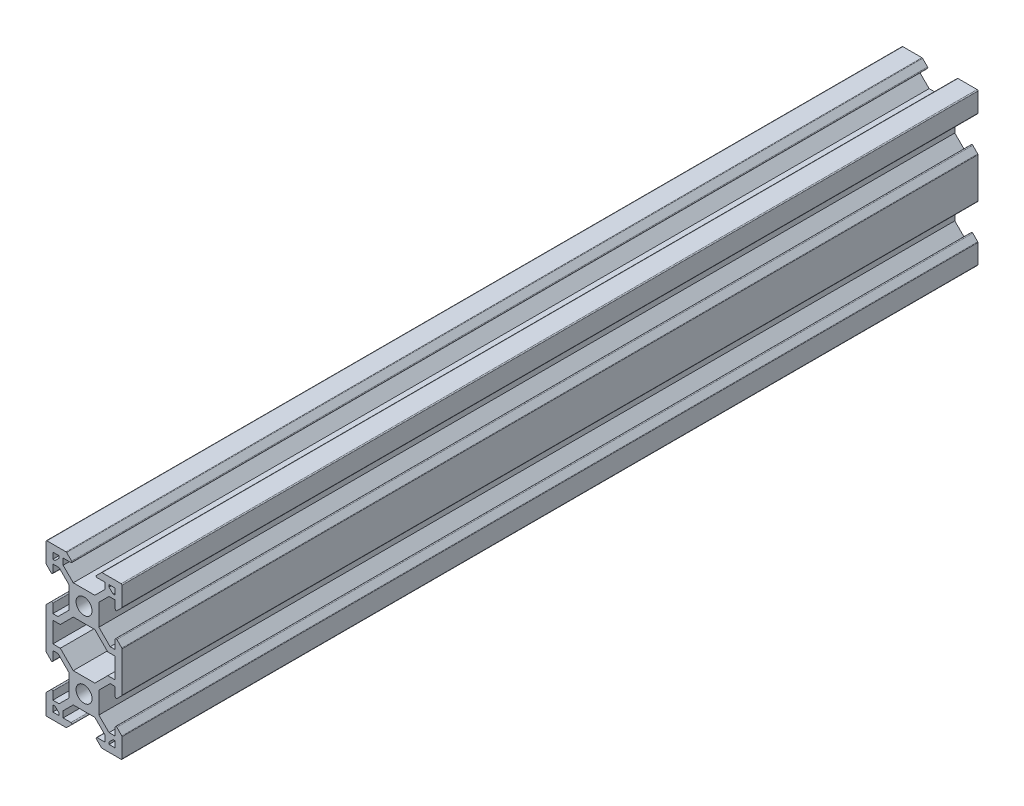
from build123d import *

# Parameters (mm, degrees)
SKETCH1_R            = 2.1
BOSS_EXTRUDE2_DEPTH  = 225
CUT_EXTRUDE1_DEPTH   = 226.44400663
FILLET1_R            = 0.25
FILLET1_OF_MIRROR1_R = 0.25


with BuildPart() as part:
    # Sketch1 → Boss-Extrude2 (new body)
    with BuildSketch(Plane.XY):
        Polygon((8.199993721, -10), (9.999993721, -10), (9.999993721, -4.63999575), (8.199993721, -2.84), (8.199993721, -5.800653822), (6.861313026, -5.800653822), (3.900652213, -2.84), (3.900652213, 2.84), (6.559993721, 5.499347787), (8.199993721, 5.499347787), (8.199993721, 2.84), (9.999993721, 4.64000425), (9.999993721, 10), (4.63999575, 10), (2.84, 8.2), (5.499325592, 8.2), (5.499325592, 6.56), (2.84, 3.900668129), (-2.84, 3.900668129), (-5.49933815, 6.56), (-5.49933815, 8.2), (-2.84, 8.2), (-4.64000425, 10), (-10.000006279, 10), (-10.000006279, 4.63999575), (-8.200006279, 2.84), (-8.200006279, 5.499347787), (-6.560006279, 5.499347787), (-3.900652213, 2.84), (-3.900652213, -2.84), (-6.861299044, -5.800653822), (-8.200006279, -5.800653822), (-8.200006279, -2.84), (-10.000006279, -4.64000425), (-10.000006279, -10), (-8.200006279, -10), (-8.200006279, -7.300653822), (-6.239977665, -7.300653822), (-2.84, -3.900668129), (2.84, -3.900668129), (6.239993721, -7.300653822), (8.199993721, -7.300653822), align=None)
        with Locations(Location((0, 0, 0), (0, 0, 180))):
            Circle(SKETCH1_R, mode=Mode.SUBTRACT)
    boss_extrude2 = extrude(amount=BOSS_EXTRUDE2_DEPTH)

    # Sketch2 → Cut-Extrude1 (cut, through all)
    with BuildSketch(Plane.XY.offset(225)):
        Polygon((-8.200006279, 6.569347787), (-8.200006279, 8.2), (-6.56933815, 8.2), (-6.56933815, 7.630009211), (-7.62999707, 6.569347787), align=None)
        Polygon((8.199993721, 8.2), (8.199993721, 6.569347787), (7.629987016, 6.569347787), (6.569325592, 7.630006706), (6.569325592, 8.2), align=None)
    cut_extrude1 = extrude(amount=-CUT_EXTRUDE1_DEPTH, mode=Mode.SUBTRACT)

    # Fillet1
    fillet1_edges = [part.edges().sort_by_distance(p)[0] for p in [
        (9.999993721, -4.63999575, 112.5),
        (-10.000006279, -4.64000425, 112.5),
        (-8.200006279, -2.84, 112.5),
        (-8.200006279, 2.84, 112.5),
        (-10.000006279, 4.63999575, 112.5),
        (-10.000006279, 10, 112.5),
        (-4.64000425, 10, 112.5),
        (-2.84, 8.2, 112.5),
        (2.84, 8.2, 112.5),
        (4.63999575, 10, 112.5),
        (9.999993721, 10, 112.5),
        (9.999993721, 4.64000425, 112.5),
        (8.199993721, 2.84, 112.5),
        (8.199993721, -2.84, 112.5),
    ]]
    fillet(fillet1_edges, radius=FILLET1_R)

    # Mirror1: Boss-Extrude2 across plane
    add(boss_extrude2.mirror(Plane(origin=(0, -10, 0), x_dir=(0, 0, 1), z_dir=(0, -1, 0))))

    # Fillet1 of Mirror1
    fillet1_of_mirror1_edges = [part.edges().sort_by_distance(p)[0] for p in [
        (9.999993721, -15.36000425, 112.5),
        (-10.000006279, -15.35999575, 112.5),
        (-8.200006279, -17.16, 112.5),
        (-8.200006279, -22.84, 112.5),
        (-10.000006279, -24.63999575, 112.5),
        (-10.000006279, -30, 112.5),
        (-4.64000425, -30, 112.5),
        (-2.84, -28.2, 112.5),
        (2.84, -28.2, 112.5),
        (4.63999575, -30, 112.5),
        (9.999993721, -30, 112.5),
        (9.999993721, -24.64000425, 112.5),
        (8.199993721, -22.84, 112.5),
        (8.199993721, -17.16, 112.5),
    ]]
    fillet(fillet1_of_mirror1_edges, radius=FILLET1_OF_MIRROR1_R)

    # Mirror2: Cut-Extrude1 across plane
    add(cut_extrude1.mirror(Plane(origin=(0, -10, 0), x_dir=(0, 0, 1), z_dir=(0, -1, 0))), mode=Mode.SUBTRACT)


solid = part.part
